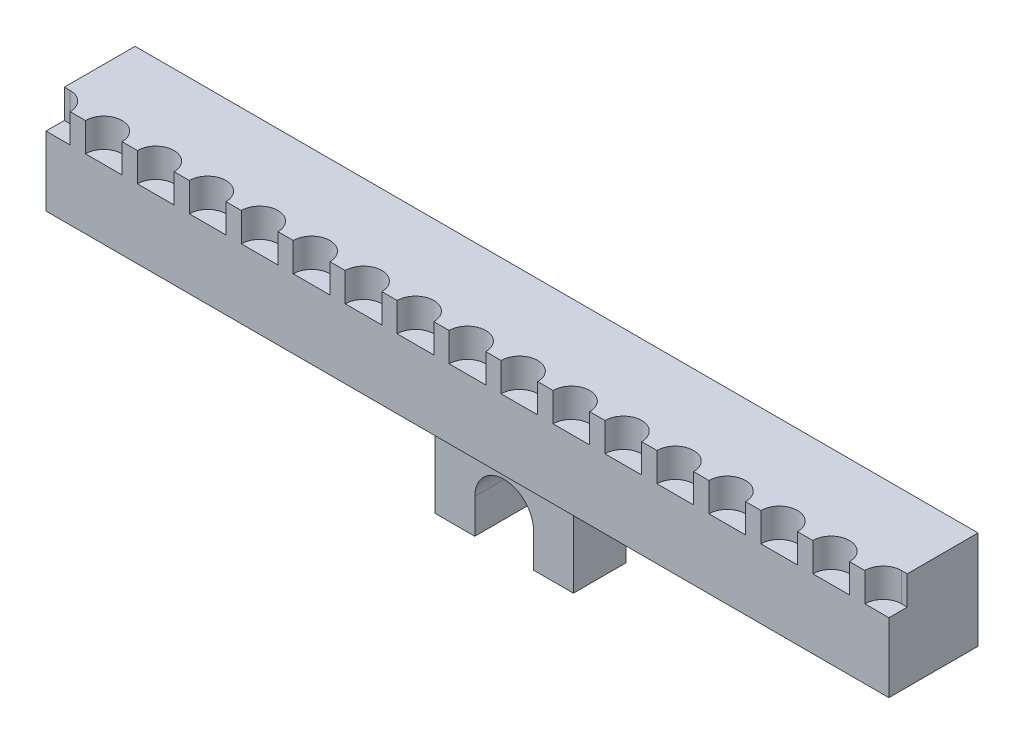
from build123d import *

# Parameters (mm, degrees)
SKETCH1_W                       = 73
SKETCH1_H                       = 7.715
BOSS_EXTRUDE1_DEPTH             = 8.5
BOSS_EXTRUDE5_REACH             = 40.165
BOSS_EXTRUDE5_DIRECTION_2_REACH = 40.165
SKETCH6_W                       = 12
SKETCH6_H                       = 3.715
CUT_EXTRUDE1_DEPTH              = 9
SKETCH7_R                       = 1.5875
CUT_EXTRUDE2_DEPTH              = 2.5
CUT_EXTRUDE3_DEPTH              = 2.54
BOSS_EXTRUDE6_DEPTH             = 2.54


with BuildPart() as part:
    # Sketch1 → Boss-Extrude1 (new body)
    with BuildSketch(Plane(origin=(0, 0, 0), x_dir=(1, 0, 0), z_dir=(0, 1, 0))):
        with Locations((0, -3.3575)):
            Rectangle(SKETCH1_W, SKETCH1_H)
    extrude(amount=BOSS_EXTRUDE1_DEPTH)

    # Boss-Extrude5: up to this face of the body (flat: up to its plane)
    boss_extrude5_end = Plane(part.part.faces().sort_by_distance((0, 4.25, 7.215))[0])
    # Sketch5 → Boss-Extrude5 (add, up to the picked face)
    with BuildSketch(Plane.XY, mode=Mode.PRIVATE) as boss_extrude5_sk1:
        with BuildLine():
            Line((-2.54, -6), (-2.54, -9))
            Line((-2.54, -9), (-6, -9))
            Line((-6, -9), (-6, 0))
            Line((-6, 0), (6, 0))
            Line((6, 0), (6, -9))
            Line((6, -9), (2.54, -9))
            Line((2.54, -9), (2.54, -6))
            ThreePointArc((2.54, -6), (0, -3.46), (-2.54, -6))
        make_face()
    boss_extrude5_tool1 = split(extrude(boss_extrude5_sk1.sketch, amount=BOSS_EXTRUDE5_REACH, mode=Mode.PRIVATE), bisect_by=boss_extrude5_end, keep=Keep.BOTH, mode=Mode.PRIVATE)
    add(boss_extrude5_tool1.solids().sort_by(Axis((-2.69, -7.5, 0), (0, 0, 1)))[0])

    # Boss-Extrude5 direction 2: up to this face of the body (flat: up to its plane)
    boss_extrude5_direction_2_end = Plane(part.part.faces().sort_by_distance((0, 4.25, -0.5))[0])
    # Sketch5 → Boss-Extrude5 direction 2 (add, up to the picked face)
    with BuildSketch(Plane.XY, mode=Mode.PRIVATE) as boss_extrude5_direction_2_sk1:
        with BuildLine():
            Line((-2.54, -6), (-2.54, -9))
            Line((-2.54, -9), (-6, -9))
            Line((-6, -9), (-6, 0))
            Line((-6, 0), (6, 0))
            Line((6, 0), (6, -9))
            Line((6, -9), (2.54, -9))
            Line((2.54, -9), (2.54, -6))
            ThreePointArc((2.54, -6), (0, -3.46), (-2.54, -6))
        make_face()
    boss_extrude5_direction_2_tool1 = split(extrude(boss_extrude5_direction_2_sk1.sketch, amount=-BOSS_EXTRUDE5_DIRECTION_2_REACH, mode=Mode.PRIVATE), bisect_by=boss_extrude5_direction_2_end, keep=Keep.BOTH, mode=Mode.PRIVATE)
    add(boss_extrude5_direction_2_tool1.solids().sort_by(Axis((-2.69, -7.5, 0), (0, 0, -1)))[0])

    # Sketch6 → Cut-Extrude1 (cut)
    with BuildSketch(Plane.XZ.offset(9)):
        with Locations((0, 3.3575)):
            Rectangle(SKETCH6_W, SKETCH6_H)
    extrude(amount=-CUT_EXTRUDE1_DEPTH, mode=Mode.SUBTRACT)

    # Sketch7 → Cut-Extrude2 (cut)
    with BuildSketch(Plane(origin=(0, 8.5, 0), x_dir=(1, 0, 0), z_dir=(0, 1, 0))):
        with Locations((0, -7.215)):
            Circle(SKETCH7_R)
        with Locations((4.5, -7.215)):
            Circle(SKETCH7_R)
        with Locations((9, -7.215)):
            Circle(SKETCH7_R)
        with Locations((13.5, -7.215)):
            Circle(SKETCH7_R)
        with Locations((18, -7.215)):
            Circle(SKETCH7_R)
        with Locations((22.5, -7.215)):
            Circle(SKETCH7_R)
        with Locations((27, -7.215)):
            Circle(SKETCH7_R)
        with Locations((31.5, -7.215)):
            Circle(SKETCH7_R)
        with Locations((-31.5, -7.215)):
            Circle(SKETCH7_R)
        with Locations((-27, -7.215)):
            Circle(SKETCH7_R)
        with Locations((-22.5, -7.215)):
            Circle(SKETCH7_R)
        with Locations((-18, -7.215)):
            Circle(SKETCH7_R)
        with Locations((-13.5, -7.215)):
            Circle(SKETCH7_R)
        with Locations((-9, -7.215)):
            Circle(SKETCH7_R)
        with Locations((-4.5, -7.215)):
            Circle(SKETCH7_R)
        with BuildLine():
            Line((36, -5.6275), (36.5, -5.6275))
            Line((36.5, -5.6275), (36.5, -5.70829623))
            ThreePointArc((36.5, -5.70829623), (35.746757018, -8.782170776), (36, -5.6275))
        make_face()
        with BuildLine():
            Line((-36.5, -5.6275), (-36.5, -5.70829623))
            ThreePointArc((-36.5, -5.70829623), (-35.746757018, -8.782170776), (-36, -5.6275))
            Line((-36, -5.6275), (-36.5, -5.6275))
        make_face()
    extrude(amount=-CUT_EXTRUDE2_DEPTH, mode=Mode.SUBTRACT)

    # Sketch8 → Cut-Extrude3 (cut)
    with BuildSketch(Plane(origin=(0, 0, 5.215), x_dir=(-1, 0, 0), z_dir=(0, 0, -1))):
        with BuildLine():
            Line((2.54, -6), (2.54, -9))
            Line((2.54, -9), (6, -9))
            Line((6, -9), (6, 0))
            Line((6, 0), (-6, 0))
            Line((-6, 0), (-6, -9))
            Line((-6, -9), (-2.54, -9))
            Line((-2.54, -9), (-2.54, -6))
            ThreePointArc((-2.54, -6), (0, -3.46), (2.54, -6))
        make_face()
    extrude(amount=-CUT_EXTRUDE3_DEPTH, mode=Mode.SUBTRACT)

    # Sketch9 → Boss-Extrude6 (add)
    with BuildSketch(Plane.XY.offset(1.5)):
        with BuildLine():
            Line((2.54, -9), (6, -9))
            Line((6, -9), (6, 0))
            Line((6, 0), (-6, 0))
            Line((-6, 0), (-6, -9))
            Line((-6, -9), (-2.54, -9))
            Line((-2.54, -9), (-2.54, -6))
            ThreePointArc((-2.54, -6), (0, -3.46), (2.54, -6))
            Line((2.54, -6), (2.54, -9))
        make_face()
    extrude(amount=BOSS_EXTRUDE6_DEPTH)


solid = part.part
